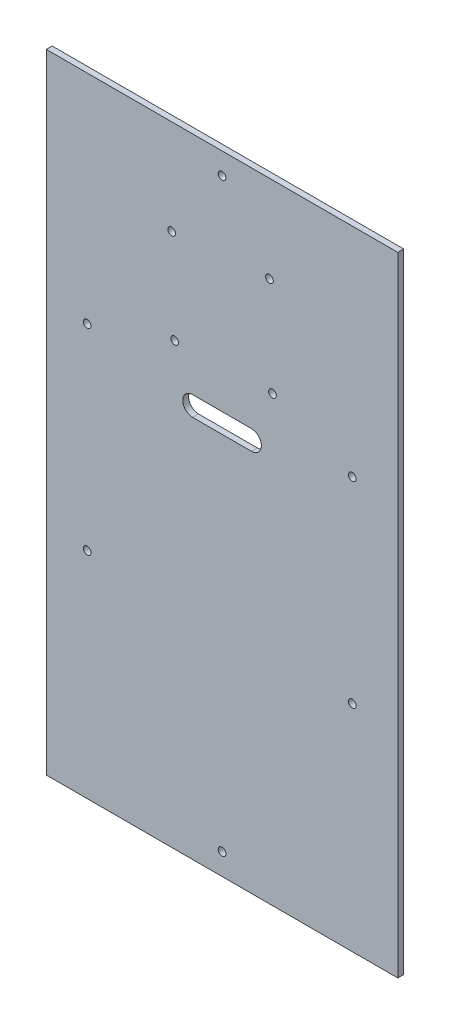
from build123d import *

# Parameters (mm, degrees)
CROQUIS2_W                     = 179
CROQUIS2_H                     = 320
SALIENTE_EXTRUIR1_DEPTH        = 3
TALADRO_DE_MARGEN_PARA_M3_51_D = 3.9
CORTAR_EXTRUIR1_DEPTH          = 184.355528959
TALADRO_DE_MARGEN_PARA_M3_52_D = 3.9


with BuildPart() as part:
    # Croquis2 → Saliente-Extruir1 (new body)
    with BuildSketch(Plane.XY):
        Rectangle(CROQUIS2_W, CROQUIS2_H)
    extrude(amount=SALIENTE_EXTRUIR1_DEPTH)

    # Taladro de margen para M3.51 (through all)
    with Locations(Plane.XY.offset(3)):
        with Locations((0, 149), (-68.69, 49.42), (66.31, 49.42), (-68.69, -50.58), (0, -149), (66.31, -50.58)):
            Hole(TALADRO_DE_MARGEN_PARA_M3_51_D / 2)

    # robot arm bores → Cortar-Extruir1 (cut, through all)
    with BuildSketch(Plane.XY.offset(3)):
        with BuildLine():
            Line((-15, 45), (15, 45))
            ThreePointArc((15, 45), (20, 40), (15, 35))
            Line((15, 35), (-15, 35))
            ThreePointArc((-15, 35), (-20, 40), (-15, 45))
        make_face()
    extrude(amount=-CORTAR_EXTRUIR1_DEPTH, mode=Mode.SUBTRACT)

    # Taladro de margen para M3.52 (through all)
    with Locations(Plane.XY.offset(3)):
        with Locations((-24.154111306, 64.317986379), (25.673602741, 65.84242489), (24.14916423, 115.670138938), (-25.623407417, 111.66583138)):
            Hole(TALADRO_DE_MARGEN_PARA_M3_52_D / 2)


solid = part.part
